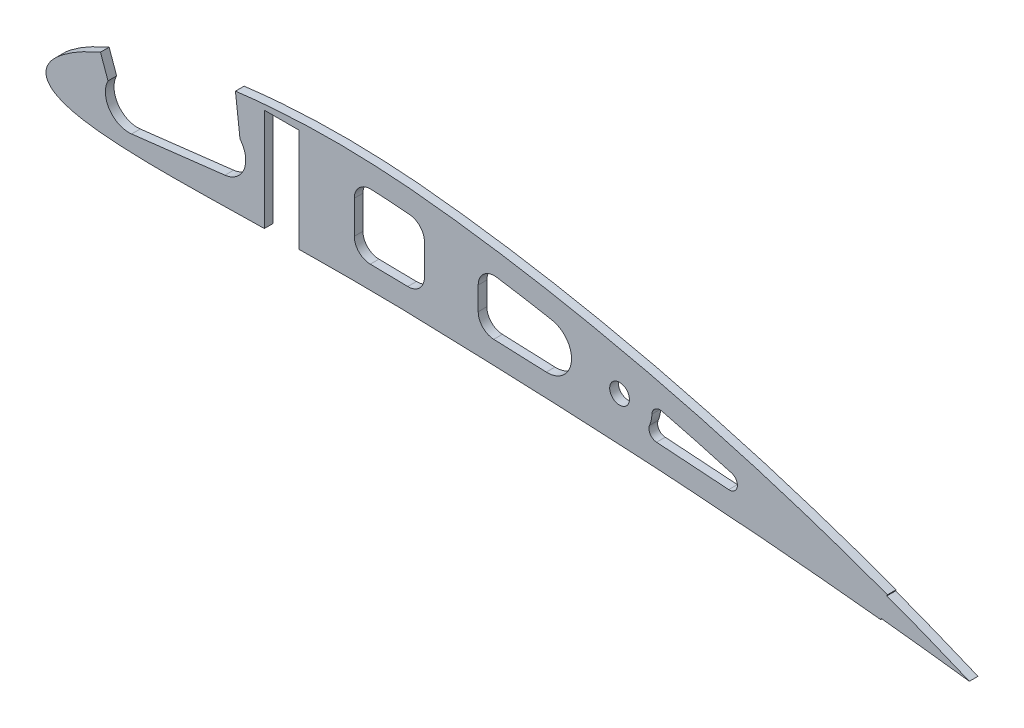
from build123d import *

# Parameters (mm, degrees)
SKETCH1_R           = 3.8862
BOSS_EXTRUDE1_DEPTH = 3.4036


with BuildPart() as part:
    # Sketch1 → Boss-Extrude1 (new body)
    with BuildSketch(Plane.XY):
        with BuildLine():
            Line((2483.023980975, 2922.879591687), (2519.777608908, 2927.20949869))
            ThreePointArc((2519.777608908, 2927.20949869), (2527.319863632, 2933.049385734), (2525.694170086, 2942.448694619))
            Line((2525.694170086, 2942.448694619), (2523.895941315, 2957.917678802))
            add(Edge.make_bspline(
                [(2780.542721306, 2914.529270217), (2778.253003884, 2915.383230056), (2775.973270324, 2916.252507472), (2770.710976164, 2918.135517361), (2767.725148574, 2919.187629166), (2758.748784649, 2922.376783211), (2752.683897054, 2924.364216578), (2740.538782354, 2928.281606169), (2734.455623744, 2930.202608214), (2722.213291432, 2933.804023839), (2716.066133268, 2935.522053802), (2703.759263564, 2938.919774314), (2697.56608772, 2940.459391466), (2685.197798544, 2943.58101684), (2678.980101095, 2944.965020182), (2659.245529669, 2949.305202793), (2645.743376553, 2951.878946596), (2623.385680041, 2955.42860469), (2614.720124938, 2956.652317038), (2599.841966526, 2958.36392012), (2593.711900835, 2959.029603565), (2581.391633876, 2959.882358149), (2575.218871474, 2960.175273737), (2562.883621226, 2960.431197012), (2556.711754315, 2960.366832438), (2544.37468429, 2959.861670338), (2538.213546048, 2959.461809989), (2529.344015147, 2958.58123427), (2526.617234193, 2958.270269513), (2523.895941315, 2957.917678802)],
                knots=[1.615895701, 1.615895701, 1.615895701, 1.615895701, 1.904435817, 1.904435817, 2.27721661, 2.27721661, 3.031526478, 3.031526478, 3.785836345, 3.785836345, 4.540146213, 4.540146213, 5.29445608, 5.29445608, 6.048765948, 6.048765948, 7.680004167, 7.680004167, 8.718618599, 8.718618599, 9.449269402, 9.449269402, 10.179920204, 10.179920204, 10.910571006, 10.910571006, 11.641221808, 11.641221808, 11.966162559, 11.966162559, 11.966162559, 11.966162559], degree=3))
            Line((2780.542721306, 2914.529270217), (2780.366179259, 2914.055865234))
            add(Edge.make_bspline(
                [(2812.811153408, 2901.172882782), (2811.742721472, 2901.619823869), (2810.661000778, 2902.065310891), (2805.162016263, 2904.346151034), (2800.746808293, 2906.133900582), (2791.811027497, 2909.75514214), (2787.390855916, 2911.450686961), (2782.055306735, 2913.429144729), (2781.210779035, 2913.742639084), (2780.366179259, 2914.055865234)],
                knots=[0.240373092, 0.240373092, 0.240373092, 0.240373092, 0.376824745, 0.376824745, 0.94322841, 0.94322841, 1.509632074, 1.509632074, 1.616176715, 1.616176715, 1.616176715, 1.616176715], degree=3))
            add(Edge.make_bspline(
                [(2778.019298543, 2905.268221897), (2779.174843082, 2905.141208585), (2780.33031454, 2905.011723055), (2787.996855373, 2904.13409815), (2794.540348084, 2903.425147632), (2804.935623835, 2902.145836788), (2808.829276968, 2901.625927636), (2812.811153408, 2901.172882782)],
                knots=[28.432746502, 28.432746502, 28.432746502, 28.432746502, 28.569989508, 28.569989508, 29.343340852, 29.343340852, 29.81381441, 29.81381441, 29.81381441, 29.81381441], degree=3))
            Line((2778.019298543, 2905.268221897), (2777.967751396, 2904.744309907))
            add(Edge.make_bspline(
                [(2548.870346536, 2916.492025464), (2549.880763048, 2916.504727314), (2552.565327641, 2916.539957413), (2556.947797606, 2916.600833489), (2562.030529235, 2916.602584186), (2567.173828356, 2916.617749693), (2572.377983544, 2916.633446074), (2577.654631688, 2916.60121101), (2582.978163683, 2916.506296333), (2588.350084988, 2916.460369428), (2593.779620592, 2916.275520794), (2599.307416132, 2916.121429226), (2604.908682597, 2915.942858659), (2610.572157053, 2915.7907425), (2616.257225785, 2915.546231142), (2621.969941233, 2915.400761443), (2627.679751972, 2915.169902487), (2633.40209681, 2914.957839244), (2639.136822152, 2914.753826197), (2644.868715349, 2914.489340909), (2650.588345306, 2914.237056417), (2656.296308508, 2914.0049192), (2661.987661359, 2913.683572201), (2667.671808974, 2913.479887199), (2673.311212153, 2913.12730793), (2678.915236244, 2912.81922031), (2684.481545426, 2912.499744001), (2690.011544993, 2912.197350816), (2695.489391996, 2911.851877341), (2700.902150582, 2911.46333457), (2706.254125464, 2911.092358664), (2711.544005033, 2910.719338581), (2716.748448208, 2910.364445801), (2721.876237554, 2909.97361868), (2726.912041029, 2909.519906738), (2731.881695192, 2909.165801077), (2736.757779223, 2908.729013424), (2741.539063821, 2908.339834691), (2746.215557291, 2907.885770826), (2750.770763986, 2907.460392739), (2755.214578157, 2907.037980676), (2759.534567055, 2906.61937141), (2763.74642736, 2906.232624217), (2767.826055945, 2905.766981735), (2771.793322217, 2905.412913174), (2775.151456937, 2905.016765849), (2777.200029602, 2904.819845242), (2777.967751396, 2904.744309907)],
                knots=[19.396955855, 19.396955855, 19.396955855, 19.396955855, 19.516306022, 19.714059236, 19.914611374, 20.116619667, 20.321540433, 20.529276424, 20.739840618, 20.950404813, 21.163744737, 21.381461041, 21.603553869, 21.825646696, 22.050605171, 22.275615756, 22.500574231, 22.725532706, 22.951950418, 23.17832576, 23.403241591, 23.628157423, 23.853040081, 24.076496408, 24.299895492, 24.520374829, 24.739394295, 24.958413761, 25.174498693, 25.387658693, 25.599358693, 25.808138693, 26.013998693, 26.215483983, 26.415525295, 26.611170743, 26.803912863, 26.993735323, 27.177747459, 27.358840435, 27.534095176, 27.704971321, 27.871468943, 28.033634134, 28.189915523, 28.34186779, 28.432980691, 28.432980691, 28.432980691, 28.432980691], degree=3))
            Line((2548.870346536, 2916.492025464), (2548.863805049, 2917.012392612))
            Line((2548.863805049, 2917.012392612), (2548.863805049, 2957.117159755))
            Line((2548.863805049, 2957.117159755), (2535.274805049, 2957.117159755))
            Line((2535.274805049, 2957.117159755), (2535.274805049, 2916.767297235))
            add(Edge.make_bspline(
                [(2470.766103702, 2944.634393971), (2470.646363815, 2944.582306298), (2470.526712246, 2944.530019788), (2466.913650609, 2942.943913199), (2463.464058775, 2941.268503699), (2457.884399007, 2937.839792176), (2455.608911301, 2936.246369969), (2451.964070041, 2932.8995014), (2450.465728267, 2931.171640714), (2449.289153427, 2927.964904632), (2449.156845546, 2926.664019066), (2449.952027869, 2924.288260351), (2450.809883366, 2923.239037065), (2452.679965619, 2921.756663811), (2453.700996299, 2921.199104676), (2455.737837909, 2920.260004144), (2456.824400221, 2919.88929622), (2460.204069688, 2918.831622145), (2462.568258916, 2918.371628463), (2467.320698583, 2917.596061883), (2469.719825171, 2917.330285057), (2476.948343474, 2916.688795145), (2481.784959026, 2916.435447913), (2491.469537197, 2916.205421666), (2496.312043463, 2916.194165047), (2511.07935418, 2916.278128573), (2520.979134882, 2916.50851683), (2532.350045622, 2916.711273345), (2533.812383917, 2916.739013275), (2535.274805049, 2916.767297235)],
                knots=[14.135708649, 14.135708649, 14.135708649, 14.135708649, 14.151211266, 14.151211266, 14.60418364, 14.60418364, 14.932415743, 14.932415743, 15.199764537, 15.199764537, 15.36293217, 15.36293217, 15.526099802, 15.526099802, 15.662859963, 15.662859963, 15.799620124, 15.799620124, 16.08612483, 16.08612483, 16.372629537, 16.372629537, 16.94563895, 16.94563895, 17.518648363, 17.518648363, 18.689255122, 18.689255122, 18.862005391, 18.862005391, 18.862005391, 18.862005391], degree=3))
            Line((2470.766103702, 2944.634393971), (2473.727927056, 2936.326605121))
            ThreePointArc((2473.727927056, 2936.326605121), (2474.331071197, 2926.806830745), (2483.023980975, 2922.879591687))
        make_face()
        with Locations((2675.105839614, 2930.366070938)):
            Circle(SKETCH1_R, mode=Mode.SUBTRACT)
        with BuildLine():
            Line((2570.682405049, 2944.794741249), (2570.682405049, 2931.827587658))
            ThreePointArc((2570.682405049, 2931.827587658), (2572.520423319, 2927.359420152), (2576.970443117, 2925.477889971))
            add(Edge.make_bspline(
                [(2576.970443117, 2925.477889971), (2578.946013457, 2925.458611863), (2580.908312845, 2925.433557065), (2585.707832405, 2925.368115189), (2588.785659852, 2925.327075025), (2591.740768935, 2925.239203793)],
                knots=[20.499375392, 20.499375392, 20.499375392, 20.499375392, 20.729094517, 20.729094517, 21.074129702, 21.074129702, 21.074129702, 21.074129702], degree=3))
            ThreePointArc((2591.740768935, 2925.239203793), (2596.35240148, 2927.030030585), (2598.279505049, 2931.586398345))
            Line((2598.279505049, 2931.586398345), (2598.279505049, 2943.802406816))
            ThreePointArc((2598.279505049, 2943.802406816), (2596.615617992, 2948.087595901), (2592.495931666, 2950.12709344))
            add(Edge.make_bspline(
                [(2592.495931666, 2950.12709344), (2589.264462047, 2950.416497566), (2586.039016785, 2950.661712776), (2580.958288395, 2950.96118464), (2579.137197366, 2951.056515933), (2577.317642729, 2951.138331673)],
                knots=[9.222323649, 9.222323649, 9.222323649, 9.222323649, 9.617156173, 9.617156173, 9.837955915, 9.837955915, 9.837955915, 9.837955915], degree=3))
            ThreePointArc((2577.317642729, 2951.138331673), (2572.644282402, 2949.38460831), (2570.682405049, 2944.794741249))
        make_face(mode=Mode.SUBTRACT)
        with BuildLine():
            Line((2619.463105049, 2939.60165617), (2619.463105049, 2930.497318936))
            ThreePointArc((2619.463105049, 2930.497318936), (2621.237956538, 2926.093852564), (2625.570354214, 2924.15196063))
            add(Edge.make_bspline(
                [(2625.570354214, 2924.15196063), (2627.901978398, 2924.062760984), (2630.192399624, 2923.972723927), (2637.052732353, 2923.721110449), (2641.706061455, 2923.528301657), (2646.263618968, 2923.327303264)],
                knots=[22.403985958, 22.403985958, 22.403985958, 22.403985958, 22.677700566, 22.677700566, 23.217183906, 23.217183906, 23.217183906, 23.217183906], degree=3))
            ThreePointArc((2646.263618968, 2923.327303264), (2656.146412526, 2931.759155132), (2648.426111877, 2942.207250284))
            add(Edge.make_bspline(
                [(2648.426111877, 2942.207250284), (2641.59243129, 2943.47910787), (2634.73375431, 2944.647297407), (2627.489460935, 2945.76871043), (2627.131613624, 2945.823795039), (2626.773872655, 2945.878552347)],
                knots=[6.961493486, 6.961493486, 6.961493486, 6.961493486, 7.79451578, 7.79451578, 7.837818242, 7.837818242, 7.837818242, 7.837818242], degree=3))
            ThreePointArc((2626.773872655, 2945.878552347), (2621.676583219, 2944.419507055), (2619.463105049, 2939.60165617))
        make_face(mode=Mode.SUBTRACT)
        with BuildLine():
            ThreePointArc((2686.916771023, 2925.494399181), (2687.580669946, 2927.607467192), (2687.869645343, 2929.80344338))
            ThreePointArc((2687.869645343, 2929.80344338), (2689.145550797, 2932.210339787), (2691.817251109, 2932.742413546))
            add(Edge.make_bspline(
                [(2719.203869949, 2925.391730292), (2714.238092072, 2926.81229723), (2709.231509514, 2928.215290454), (2700.184998092, 2930.632315246), (2696.020099344, 2931.683526164), (2691.817251109, 2932.742413546)],
                knots=[4.060379897, 4.060379897, 4.060379897, 4.060379897, 4.675695902, 4.675695902, 5.188469227, 5.188469227, 5.188469227, 5.188469227], degree=3))
            ThreePointArc((2719.203869949, 2925.391730292), (2721.456611216, 2921.783463788), (2718.098293363, 2919.17269157))
            add(Edge.make_bspline(
                [(2689.668722188, 2921.114033287), (2690.923606701, 2921.041516161), (2692.18303199, 2920.966372676), (2699.065872366, 2920.530782285), (2704.600706314, 2920.118512178), (2712.774522449, 2919.546447051), (2715.42427843, 2919.368887441), (2718.098293363, 2919.17269157)],
                knots=[24.923660459, 24.923660459, 24.923660459, 24.923660459, 25.070608892, 25.070608892, 25.727122197, 25.727122197, 26.039951507, 26.039951507, 26.039951507, 26.039951507], degree=3))
            ThreePointArc((2689.668722188, 2921.114033287), (2687.163429033, 2922.594726003), (2686.916771023, 2925.494399181))
        make_face(mode=Mode.SUBTRACT)
    extrude(amount=BOSS_EXTRUDE1_DEPTH)


solid = part.part
